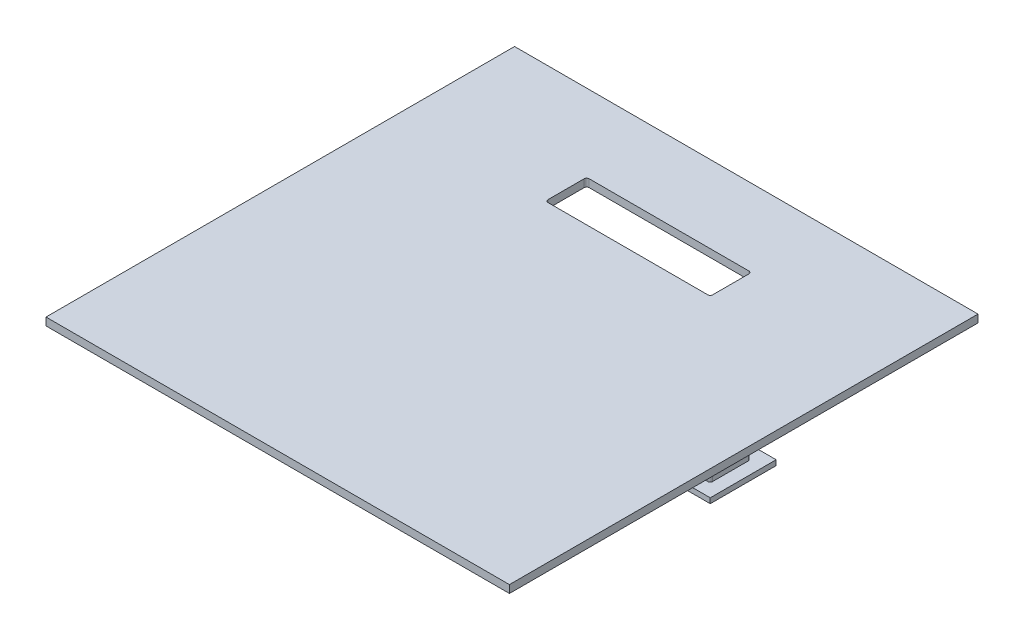
from build123d import *

# Parameters (mm, degrees)
CROQUIS2_W     = 180
CROQUIS2_H     = 182
EXTRUIR1_DEPTH = 3
CROQUIS4_W     = 64
CROQUIS4_H     = 16
EXTRUIR2_DEPTH = 10
REDONDEO1_R    = 1
EXTRUIR3_DEPTH = 3
CROQUIS7_W     = 73.6
CROQUIS7_H     = 25.6
EXTRUIR4_DEPTH = 2


with BuildPart() as part:
    # Croquis2 → Extruir1 (new body)
    with BuildSketch(Plane(origin=(0, 0, 0), x_dir=(1, 0, 0), z_dir=(0, 1, 0))):
        Rectangle(CROQUIS2_W, CROQUIS2_H)
    extrude(amount=-EXTRUIR1_DEPTH)

    # Croquis4 → Extruir2 (cut)
    with BuildSketch(Plane(origin=(0, 0, 0), x_dir=(1, 0, 0), z_dir=(0, 1, 0))):
        with Locations((0, 53)):
            Rectangle(CROQUIS4_W, CROQUIS4_H)
    extrude(amount=-EXTRUIR2_DEPTH, mode=Mode.SUBTRACT)

    # Redondeo1
    redondeo1_edges = [part.edges().sort_by_distance(p)[0] for p in [
        (-32, -1.5, -45),
        (-32, -1.5, -61),
        (32, -1.5, -61),
        (32, -1.5, -45),
    ]]
    fillet(redondeo1_edges, radius=REDONDEO1_R)


with BuildPart() as body_2:
    # Croquis5 → Extruir3 (new body)
    with BuildSketch(Plane(origin=(0, 0, 0), x_dir=(1, 0, 0), z_dir=(0, 1, 0))):
        with BuildLine():
            Line((31.8, 46), (31.8, 60))
            ThreePointArc((31.8, 60), (31.565685425, 60.565685425), (31, 60.8))
            Line((31, 60.8), (-31, 60.8))
            ThreePointArc((-31, 60.8), (-31.565685425, 60.565685425), (-31.8, 60))
            Line((-31.8, 60), (-31.8, 46))
            ThreePointArc((-31.8, 46), (-31.565685425, 45.434314575), (-31, 45.2))
            Line((-31, 45.2), (31, 45.2))
            ThreePointArc((31, 45.2), (31.565685425, 45.434314575), (31.8, 46))
        make_face()
    extrude(amount=-EXTRUIR3_DEPTH)

    # Croquis7 → Extruir4 (add)
    with BuildSketch(Plane.XZ.offset(3)):
        with Locations((0, -53)):
            Rectangle(CROQUIS7_W, CROQUIS7_H)
    extrude(amount=EXTRUIR4_DEPTH)


with BuildPart() as body_2_1:
    # Sólido-Mover/Copiar1: moved
    add(body_2.part.moved(Location((0, -60, 0))))


solid = Compound([part.part, body_2_1.part])
